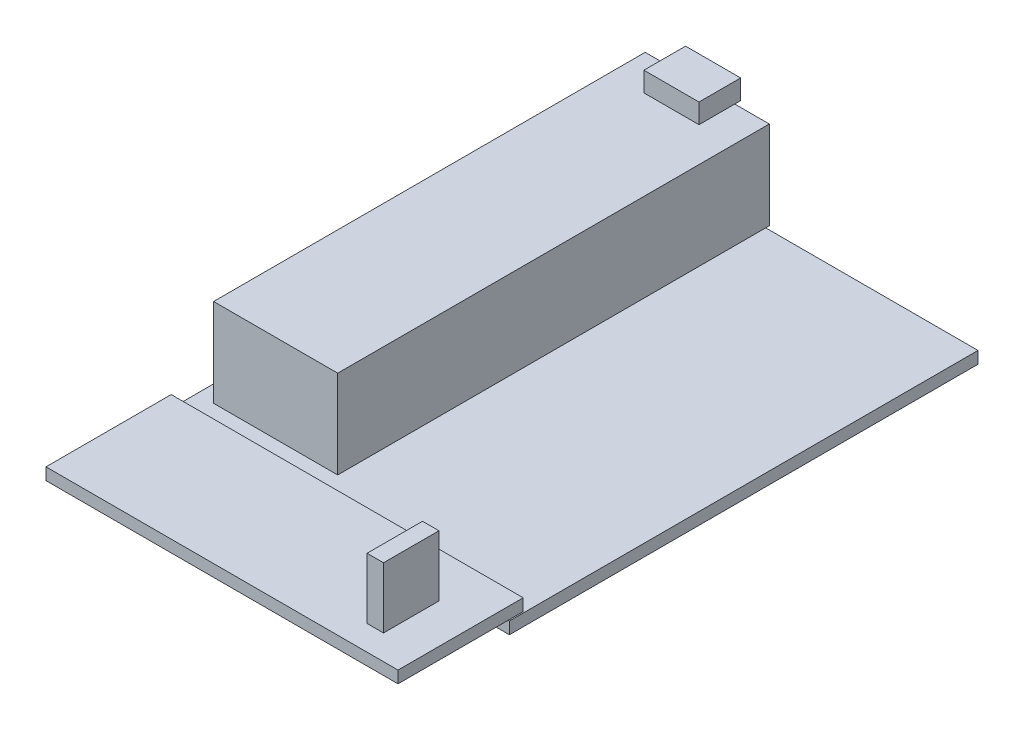
from build123d import *

# Parameters (mm, degrees)
SKETCH1_W           = 50.165
SKETCH1_H           = 66.548
BOSS_EXTRUDE1_DEPTH = 1.7
SKETCH2_W           = 49.98833795
SKETCH2_H           = 17.78
BOSS_EXTRUDE2_DEPTH = 1.7
SKETCH3_W           = 17.6276
SKETCH3_H           = 61.2902
BOSS_EXTRUDE3_DEPTH = 12.5222
SKETCH4_W           = 7.8232
SKETCH4_H           = 5.9182
BOSS_EXTRUDE4_DEPTH = 2.794
SKETCH5_W           = 2.3368
SKETCH5_H           = 7.874
BOSS_EXTRUDE5_DEPTH = 8.636


with BuildPart() as part:
    # Sketch1 → Boss-Extrude1 (new body)
    with BuildSketch(Plane(origin=(0, 0, 0), x_dir=(1, 0, 0), z_dir=(0, 1, 0))):
        with Locations((-17.53077957, -2.078202509)):
            Rectangle(SKETCH1_W, SKETCH1_H)
    extrude(amount=BOSS_EXTRUDE1_DEPTH)

    # Sketch2 → Boss-Extrude2 (add)
    with BuildSketch(Plane(origin=(0, 1.7, 0), x_dir=(1, 0, 0), z_dir=(0, 1, 0))):
        with Locations((-17.619110595, -42.108602509)):
            Rectangle(SKETCH2_W, SKETCH2_H)
    extrude(amount=BOSS_EXTRUDE2_DEPTH)

    # Sketch3 → Boss-Extrude3 (add)
    with BuildSketch(Plane(origin=(0, 1.7, 0), x_dir=(1, 0, 0), z_dir=(0, 1, 0))):
        with Locations((-31.41187957, 1.058697491)):
            Rectangle(SKETCH3_W, SKETCH3_H)
    extrude(amount=BOSS_EXTRUDE3_DEPTH)

    # Sketch4 → Boss-Extrude4 (add)
    with BuildSketch(Plane(origin=(0, 14.2222, 0), x_dir=(1, 0, 0), z_dir=(0, 1, 0))):
        with Locations((-31.41187957, 29.582897491)):
            Rectangle(SKETCH4_W, SKETCH4_H)
    extrude(amount=BOSS_EXTRUDE4_DEPTH)

    # Sketch5 → Boss-Extrude5 (add)
    with BuildSketch(Plane(origin=(0, 3.4, 0), x_dir=(1, 0, 0), z_dir=(0, 1, 0))):
        with Locations((0.61865838, -43.531002509)):
            Rectangle(SKETCH5_W, SKETCH5_H)
    extrude(amount=BOSS_EXTRUDE5_DEPTH)


solid = part.part
